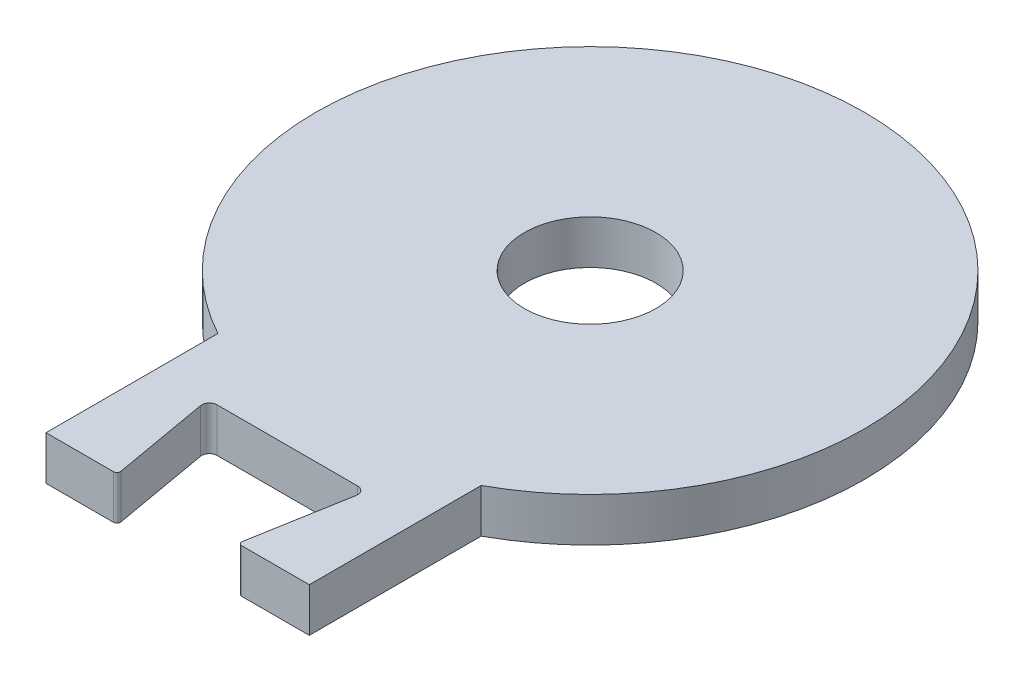
from build123d import *

# Parameters (mm, degrees)
SKETCH1_R           = 3
BOSS_EXTRUDE1_DEPTH = 2
SKETCH2_R           = 12.5
SKETCH2_R_2         = 3
BOSS_EXTRUDE2_DEPTH = 2
SKETCH4_W           = 12
SKETCH4_H           = 0.2
CUT_EXTRUDE1_DEPTH  = 4
FILLET3_R           = 0.35
FILLET4_R           = 0.15


with BuildPart() as part:
    # Sketch1 → Boss-Extrude1 (new body)
    with BuildSketch(Plane(origin=(0, 0, 0), x_dir=(1, 0, 0), z_dir=(0, 1, 0))):
        Polygon((-6, 6), (-6, -13.291502622), (-6, -19), (-2.70227506, -19), (-3.619175359, -13.8), (0, -13.8), (3.619175359, -13.8), (2.70227506, -19), (6, -19), (6, -13.291502622), (6, 6), align=None)
        with Locations(Location((0, 0, 0), (0, 0, 270))):
            Circle(SKETCH1_R, mode=Mode.SUBTRACT)
    extrude(amount=BOSS_EXTRUDE1_DEPTH)

    # Sketch2 → Boss-Extrude2 (add)
    with BuildSketch(Plane(origin=(0, 0, 0), x_dir=(1, 0, 0), z_dir=(0, 1, 0))):
        Circle(SKETCH2_R)
        with Locations(Location((0, 0, 0), (0, 0, 270))):
            Circle(SKETCH2_R_2, mode=Mode.SUBTRACT)
    extrude(amount=BOSS_EXTRUDE2_DEPTH)

    # Sketch4 → Cut-Extrude1 (cut)
    with BuildSketch(Plane(origin=(0, 2, 0), x_dir=(1, 0, 0), z_dir=(0, 1, 0))):
        with Locations((0, -18.9)):
            Rectangle(SKETCH4_W, SKETCH4_H)
    extrude(amount=-CUT_EXTRUDE1_DEPTH, mode=Mode.SUBTRACT)

    # Fillet3
    fillet3_edges = [part.edges().sort_by_distance(p)[0] for p in [
        (3.619175359, 1, 13.8),
        (-3.619175359, 1, 13.8),
    ]]
    fillet(fillet3_edges, radius=FILLET3_R)

    # Fillet4
    fillet4_edges = [part.edges().sort_by_distance(p)[0] for p in [
        (2.737540456, 1, 18.8),
        (-2.737540456, 1, 18.8),
    ]]
    fillet(fillet4_edges, radius=FILLET4_R)


solid = part.part
